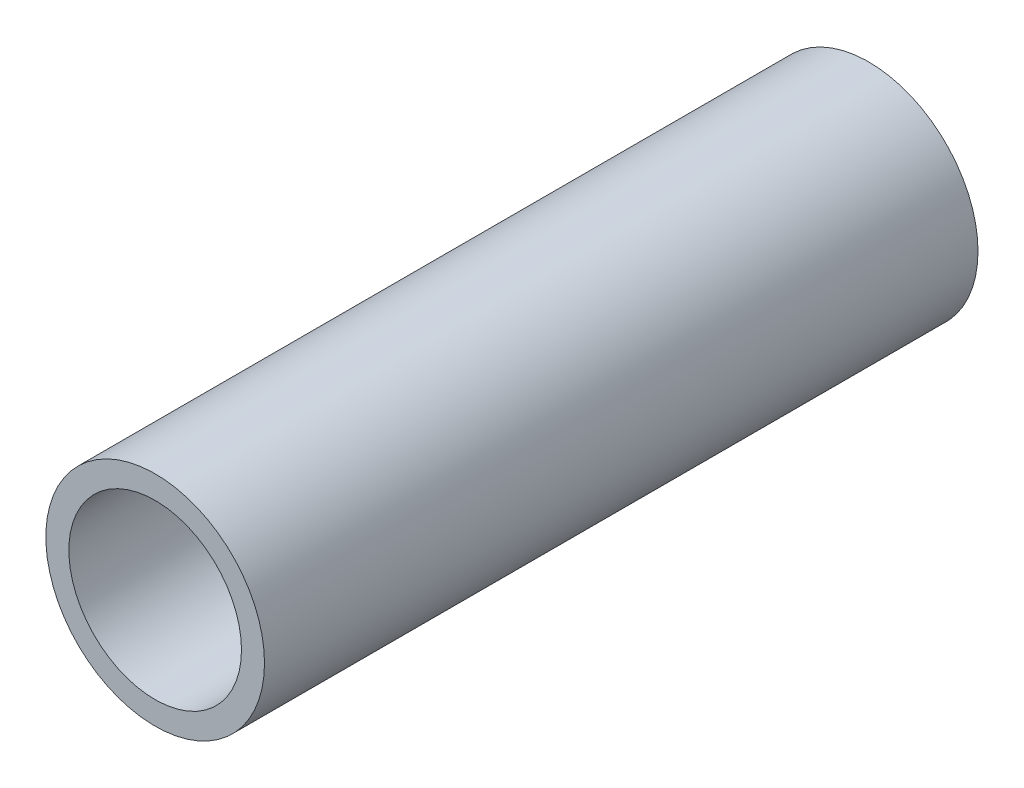
from build123d import *

# Parameters (mm, degrees)
CROQUIS1_R              = 9.5
CROQUIS1_R_2            = 7.5
SALIENTE_EXTRUIR1_DEPTH = 62


with BuildPart() as part:
    # Croquis1 → Saliente-Extruir1 (new body)
    with BuildSketch(Plane.XY):
        Circle(CROQUIS1_R)
        Circle(CROQUIS1_R_2, mode=Mode.SUBTRACT)
    extrude(amount=SALIENTE_EXTRUIR1_DEPTH)


solid = part.part
